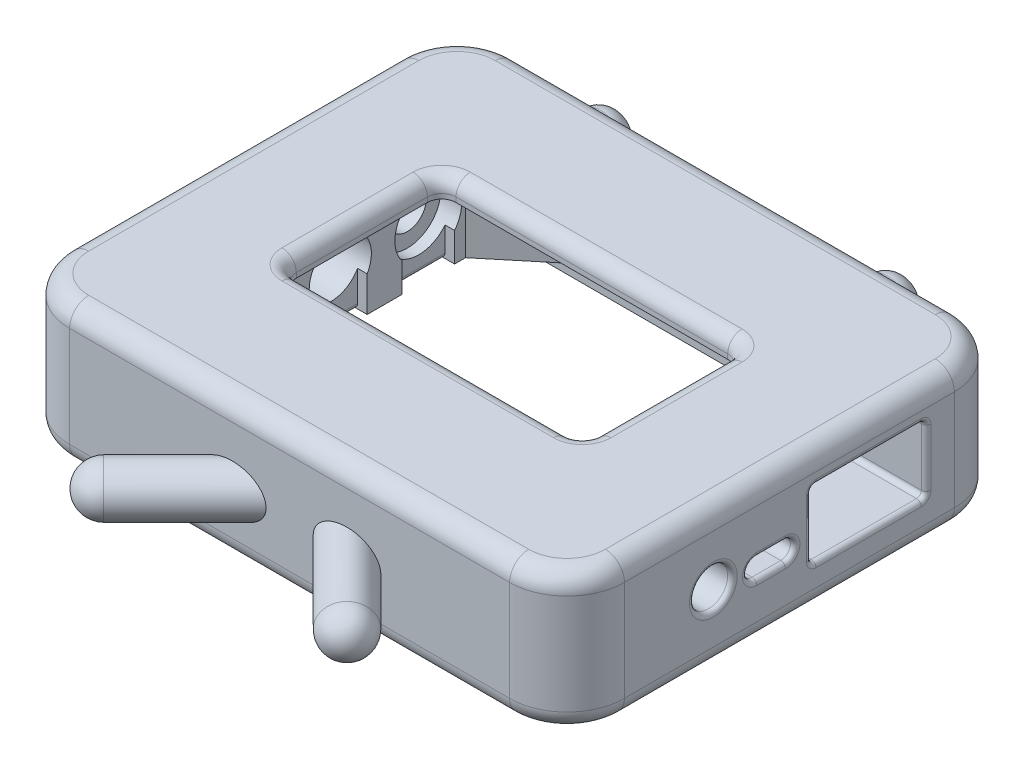
from build123d import *

# Parameters (mm, degrees)
SKETCH_1_W                  = 58
SKETCH_1_H                  = 46.5
SKETCH_1_W_2                = 38.4
SKETCH_1_H_2                = 37.4
EXTRUDE_1_DEPTH             = 12.5
SKETCH_2_W                  = 58
SKETCH_2_H                  = 46.5
SKETCH_2_W_2                = 31.4
SKETCH_2_H_2                = 16.7
EXTRUDE_2_DEPTH             = 2
FILLET_1_R                  = 6
EXTRUDE_3_DEPTH             = 12
EXTRUDE_3_DEPTH_BACK        = 3
SKETCH_8_R                  = 2.5
EXTRUDE_4_DEPTH             = 12
EXTRUDE_4_DEPTH_BACK        = 3
SKETCH_9_R                  = 2.5
FILLET_8_R                  = 2.5
FILLET_10_R                 = 2
FILLET_11_R                 = 1.5
FILLET_12_R                 = 2
SKETCH_12_W                 = 50
SKETCH_12_H                 = 37.4
CUT_EXTRUDE_1_DEPTH         = 2
FILLET_13_R                 = 5
EXTRUDE_5_DEPTH             = 10.5
CUT_EXTRUDE_3_REACH         = 70.032
SKETCH_16_R                 = 3.25
CUT_EXTRUDE_4_REACH         = 70.032
SKETCH_17_R                 = 2
CUT_EXTRUDE_5_REACH         = 70.032
SKETCH_18_R                 = 2
CUT_EXTRUDE_6_REACH         = 70.032
CUT_EXTRUDE_7_REACH         = 70.032
SKETCH_20_W                 = 12
SKETCH_20_H                 = 7
FILLET_14_R                 = 0.5
FILLET_15_R                 = 0.5
SKETCH_21_R                 = 3.5
CUT_EXTRUDE_8_DEPTH         = 2.2
CUT_EXTRUDE_START           = -2.2
SKETCH_22_R                 = 3.5
CUT_EXTRUDE_9_DEPTH         = 2.2
SKETCH_23_W                 = 5.5
SKETCH_23_H                 = 5.21
CUT_EXTRUDE_10_DEPTH        = 1
FILLET_16_R                 = 0.5
EXTRUDE_6_DEPTH             = 3
EXTRUDE_6_DIRECTION_2_REACH = 66.465
SKETCH_26_R                 = 1.05
CUT_EXTRUDE_11_DEPTH        = 8
FILLET_19_R                 = 0.5
FILLET_20_R                 = 2


with BuildPart() as part:
    # 草图1 → 凸台-拉伸1 (new body)
    with BuildSketch(Plane(origin=(0, 0, 0), x_dir=(1, 0, 0), z_dir=(0, 1, 0))):
        Rectangle(SKETCH_1_W, SKETCH_1_H)
        with Locations((0, 1.45)):
            Rectangle(SKETCH_1_W_2, SKETCH_1_H_2, mode=Mode.SUBTRACT)
    extrude(amount=EXTRUDE_1_DEPTH)

    # 草图2 → 凸台-拉伸2 (add)
    with BuildSketch(Plane(origin=(0, 12.5, 0), x_dir=(1, 0, 0), z_dir=(0, 1, 0))):
        Rectangle(SKETCH_2_W, SKETCH_2_H)
        Rectangle(SKETCH_2_W_2, SKETCH_2_H_2, mode=Mode.SUBTRACT)
    extrude(amount=EXTRUDE_2_DEPTH)

    # 圆角1
    fillet_1_edges = [part.edges().sort_by_distance(p)[0] for p in [
        (29, 7.25, 23.25),
        (-29, 7.25, 23.25),
        (-29, 7.25, -23.25),
        (29, 7.25, -23.25),
    ]]
    fillet(fillet_1_edges, radius=FILLET_1_R)

    # 草图8 → 凸台-拉伸3 (add, two sides: drawn at the far end of the back side and taken through both)
    with BuildSketch(Plane(origin=(-14.625, 0, 14.625), x_dir=(0, -1, 0), z_dir=(-0.7071067811865512, 0, 0.7071067811865438)).offset(-EXTRUDE_3_DEPTH_BACK)):
        with Locations(Location((-6.5, 12.197591975, 0), (0, 0, 90))):
            Circle(SKETCH_8_R)
    extrude(amount=EXTRUDE_3_DEPTH + EXTRUDE_3_DEPTH_BACK)

    # 草图9 → 凸台-拉伸4 (add, two sides: drawn at the far end of the back side and taken through both)
    with BuildSketch(Plane(origin=(14.625, 0, 14.625), x_dir=(0, -1, 0), z_dir=(0.7071067811865464, 0, 0.7071067811865488)).offset(-EXTRUDE_4_DEPTH_BACK)):
        with Locations(Location((-6.5, -12.197591975, 0), (0, 0, 90))):
            Circle(SKETCH_9_R)
    extrude(amount=EXTRUDE_4_DEPTH + EXTRUDE_4_DEPTH_BACK)

    # 圆角8
    fillet_8_edges = [part.edges().sort_by_distance(p)[0] for p in [
        (-16.253048327, 6.5, 29.967514421),
        (12.717514421, 6.5, 33.503048327),
    ]]
    fillet(fillet_8_edges, radius=FILLET_8_R)

    # 圆角10
    fillet_10_edges = [part.edges().sort_by_distance(p)[0] for p in [
        (0, 0, -23.25),
        (29, 0, 0),
        (0, 0, 23.25),
        (-29, 0, 0),
        (27.242640687, 0, 21.492640687),
        (-27.242640687, 0, 21.492640687),
        (-27.242640687, 0, -21.492640687),
        (27.242640687, 0, -21.492640687),
    ]]
    fillet(fillet_10_edges, radius=FILLET_10_R)

    # 圆角11
    fillet_11_edges = [part.edges().sort_by_distance(p)[0] for p in [
        (-15.7, 14.5, 0),
        (-15.7, 13.5, 8.35),
        (0, 14.5, 8.35),
        (15.7, 13.5, 8.35),
        (15.7, 14.5, 0),
        (15.7, 13.5, -8.35),
        (0, 14.5, -8.35),
        (-15.7, 13.5, -8.35),
    ]]
    fillet(fillet_11_edges, radius=FILLET_11_R)

    # 圆角12
    fillet_12_edges = [part.edges().sort_by_distance(p)[0] for p in [
        (0, 14.5, -23.25),
        (29, 14.5, 0),
        (-29, 14.5, 0),
        (0, 14.5, 23.25),
        (27.242640687, 14.5, 21.492640687),
        (-27.242640687, 14.5, 21.492640687),
        (-27.242640687, 14.5, -21.492640687),
        (27.242640687, 14.5, -21.492640687),
    ]]
    fillet(fillet_12_edges, radius=FILLET_12_R)

    # 草图12 → 切除-拉伸1 (cut)
    with BuildSketch(Plane.XZ):
        with Locations((0, -1.45)):
            Rectangle(SKETCH_12_W, SKETCH_12_H)
    extrude(amount=-CUT_EXTRUDE_1_DEPTH, mode=Mode.SUBTRACT)

    # 圆角13
    fillet_13_edges = [part.edges().sort_by_distance(p)[0] for p in [
        (25, 1, -20.15),
        (-25, 1, -20.15),
        (-25, 1, 17.25),
        (25, 1, 17.25),
    ]]
    fillet(fillet_13_edges, radius=FILLET_13_R)

    # 草图14 → 凸台-拉伸5 (add)
    with BuildSketch(Plane.XZ.offset(-12.5)):
        Polygon((-12.2, 17.25), (-19.2, 11.45), (-19.2, 17.25), align=None)
        Polygon((19.2, 17.25), (12.2, 17.25), (19.2, 11.45), align=None)
        Polygon((12.2, -20.15), (19.2, -14.35), (19.2, -20.15), align=None)
        Polygon((-19.2, -20.15), (-12.2, -20.15), (-19.2, -14.35), align=None)
    extrude(amount=EXTRUDE_5_DEPTH)

    # 草图16 → 切除-拉伸3 (cut, up to next)
    with BuildSketch(Plane.ZY.offset(29), mode=Mode.PRIVATE) as cut_extrude_3_sk1:
        with Locations((-1.25, 7.32)):
            Circle(SKETCH_16_R)
    cut_extrude_3_tool1 = extrude(cut_extrude_3_sk1.sketch, amount=-CUT_EXTRUDE_3_REACH, mode=Mode.PRIVATE) & part.part
    add(cut_extrude_3_tool1.solids().sort_by_distance((-29, 7.32, -1.25))[0], mode=Mode.SUBTRACT)

    # 草图17 → 切除-拉伸4 (cut, up to next)
    with BuildSketch(Plane.ZY.offset(29), mode=Mode.PRIVATE) as cut_extrude_4_sk1:
        with Locations((7.95, 7.21)):
            Circle(SKETCH_17_R)
    cut_extrude_4_tool1 = extrude(cut_extrude_4_sk1.sketch, amount=-CUT_EXTRUDE_4_REACH, mode=Mode.PRIVATE) & part.part
    # 草图17 → 切除-拉伸4 (cut, up to next)
    with BuildSketch(Plane.ZY.offset(29), mode=Mode.PRIVATE) as cut_extrude_4_sk2:
        with Locations((-10.45, 7.21)):
            Circle(SKETCH_17_R)
    cut_extrude_4_tool2 = extrude(cut_extrude_4_sk2.sketch, amount=-CUT_EXTRUDE_4_REACH, mode=Mode.PRIVATE) & part.part
    add(cut_extrude_4_tool1.solids().sort_by_distance((-29, 7.21, 7.95))[0], mode=Mode.SUBTRACT)
    add(cut_extrude_4_tool2.solids().sort_by_distance((-29, 7.21, -10.45))[0], mode=Mode.SUBTRACT)

    # 草图18 → 切除-拉伸5 (cut, up to next)
    with BuildSketch(Plane(origin=(29, 0, 0), x_dir=(0, 0, -1), z_dir=(1, 0, 0)), mode=Mode.PRIVATE) as cut_extrude_5_sk1:
        with Locations(Location((-7.95, 7.21, 0), (0, 0, 180))):
            Circle(SKETCH_18_R)
    cut_extrude_5_tool1 = extrude(cut_extrude_5_sk1.sketch, amount=-CUT_EXTRUDE_5_REACH, mode=Mode.PRIVATE) & part.part
    add(cut_extrude_5_tool1.solids().sort_by_distance((29, 7.21, 7.95))[0], mode=Mode.SUBTRACT)

    # 草图19 → 切除-拉伸6 (cut, up to next)
    with BuildSketch(Plane(origin=(29, 0, 0), x_dir=(0, 0, -1), z_dir=(1, 0, 0)), mode=Mode.PRIVATE) as cut_extrude_6_sk1:
        with BuildLine():
            Line((-3.4, 7.81), (-0.4, 7.81))
            ThreePointArc((-0.4, 7.81), (0.6, 6.81), (-0.4, 5.81))
            Line((-0.4, 5.81), (-3.4, 5.81))
            ThreePointArc((-3.4, 5.81), (-4.4, 6.81), (-3.4, 7.81))
        make_face()
    cut_extrude_6_tool1 = extrude(cut_extrude_6_sk1.sketch, amount=-CUT_EXTRUDE_6_REACH, mode=Mode.PRIVATE) & part.part
    add(cut_extrude_6_tool1.solids().sort_by_distance((29, 6.81, 1.9))[0], mode=Mode.SUBTRACT)

    # 草图20 → 切除-拉伸7 (cut, up to next)
    with BuildSketch(Plane(origin=(29, 0, 0), x_dir=(0, 0, -1), z_dir=(1, 0, 0)), mode=Mode.PRIVATE) as cut_extrude_7_sk1:
        with Locations((8.29, 7.82)):
            Rectangle(SKETCH_20_W, SKETCH_20_H)
    cut_extrude_7_tool1 = extrude(cut_extrude_7_sk1.sketch, amount=-CUT_EXTRUDE_7_REACH, mode=Mode.PRIVATE) & part.part
    add(cut_extrude_7_tool1.solids().sort_by_distance((29, 7.82, -8.29))[0], mode=Mode.SUBTRACT)

    # 圆角14
    fillet_14_edges = [part.edges().sort_by_distance(p)[0] for p in [
        (-29, 7.32, -4.5),
        (-29, 7.21, 5.95),
        (-29, 7.21, -12.45),
        (29, 7.21, 5.95),
        (29, 6.81, 4.4),
        (29, 5.81, 1.9),
        (29, 6.81, -0.6),
        (29, 7.81, 1.9),
        (24.1, 11.32, -14.29),
        (24.1, 4.32, -14.29),
        (24.1, 4.32, -2.29),
        (24.1, 11.32, -2.29),
    ]]
    fillet(fillet_14_edges, radius=FILLET_14_R)

    # 圆角15
    fillet_15_edges = [part.edges().sort_by_distance(p)[0] for p in [
        (29, 11.32, -8.29),
        (29, 7.82, -14.29),
        (29, 4.32, -8.29),
        (29, 7.82, -2.29),
        (29, 11.173553391, -14.143553391),
        (29, 4.466446609, -14.143553391),
        (29, 4.466446609, -2.436446609),
        (29, 11.173553391, -2.436446609),
    ]]
    fillet(fillet_15_edges, radius=FILLET_15_R)

    # 草图21 → 切除-拉伸8 (cut)
    with BuildSketch(Plane.ZY.offset(-19.2)):
        with Locations((7.95, 7.21)):
            Circle(SKETCH_21_R)
    extrude(amount=-CUT_EXTRUDE_8_DEPTH, mode=Mode.SUBTRACT)

    # 草图22 → 切除-拉伸9 (cut)
    with BuildSketch(Plane(origin=(-19.2, 0, 0), x_dir=(0, 0, -1), z_dir=(1, 0, 0)).offset(CUT_EXTRUDE_START)):
        with Locations(Location((-7.95, 7.21, 0), (0, 0, 180))):
            Circle(SKETCH_22_R)
        with Locations((10.45, 7.21)):
            Circle(SKETCH_22_R)
    extrude(amount=CUT_EXTRUDE_9_DEPTH, mode=Mode.SUBTRACT)

    # 草图23 → 切除-拉伸10 (cut)
    with BuildSketch(Plane(origin=(-19.2, 0, 0), x_dir=(0, 0, -1), z_dir=(1, 0, 0))):
        with Locations((-7.95, 4.605)):
            Rectangle(SKETCH_23_W, SKETCH_23_H)
        with Locations((1.30806142, 4.605)):
            Rectangle(SKETCH_23_W, SKETCH_23_H)
        with Locations((10.45, 4.605)):
            Rectangle(SKETCH_23_W, SKETCH_23_H)
    extrude(amount=-CUT_EXTRUDE_10_DEPTH, mode=Mode.SUBTRACT)

    # 圆角16
    fillet_16_edges = [part.edges().sort_by_distance(p)[0] for p in [
        (-20.2, 2, 7.95),
        (-20.2, 2, -1.30806142),
        (-20.2, 2, -10.45),
    ]]
    fillet(fillet_16_edges, radius=FILLET_16_R)

    # 草图24 → 凸台-拉伸6 (add)
    with BuildSketch(Plane(origin=(0, 0, -23.25), x_dir=(-1, 0, 0), z_dir=(0, 0, -1))):
        with BuildLine():
            Line((12.5, 10), (12.5, 0))
            Line((12.5, 0), (17.5, 0))
            Line((17.5, 0), (17.5, 10))
            ThreePointArc((17.5, 10), (15, 12.5), (12.5, 10))
        make_face()
        with BuildLine():
            Line((-17.5, 10), (-17.5, 0))
            Line((-17.5, 0), (-12.5, 0))
            Line((-12.5, 0), (-12.5, 10))
            ThreePointArc((-12.5, 10), (-15, 12.5), (-17.5, 10))
        make_face()
    extrude(amount=EXTRUDE_6_DEPTH)

    # 草图24 → 凸台-拉伸6 direction 2 (add, up to next)
    with BuildSketch(Plane(origin=(0, 0, -23.25), x_dir=(-1, 0, 0), z_dir=(0, 0, -1)), mode=Mode.PRIVATE) as extrude_6_direction_2_sk1:
        with BuildLine():
            Line((12.5, 10), (12.5, 0))
            Line((12.5, 0), (17.5, 0))
            Line((17.5, 0), (17.5, 10))
            ThreePointArc((17.5, 10), (15, 12.5), (12.5, 10))
        make_face()
    extrude_6_direction_2_tool1 = extrude(extrude_6_direction_2_sk1.sketch, amount=-EXTRUDE_6_DIRECTION_2_REACH, mode=Mode.PRIVATE) - part.part
    # 草图24 → 凸台-拉伸6 direction 2 (add, up to next)
    with BuildSketch(Plane(origin=(0, 0, -23.25), x_dir=(-1, 0, 0), z_dir=(0, 0, -1)), mode=Mode.PRIVATE) as extrude_6_direction_2_sk2:
        with BuildLine():
            Line((-17.5, 10), (-17.5, 0))
            Line((-17.5, 0), (-12.5, 0))
            Line((-12.5, 0), (-12.5, 10))
            ThreePointArc((-12.5, 10), (-15, 12.5), (-17.5, 10))
        make_face()
    extrude_6_direction_2_tool2 = extrude(extrude_6_direction_2_sk2.sketch, amount=-EXTRUDE_6_DIRECTION_2_REACH, mode=Mode.PRIVATE) - part.part
    add(extrude_6_direction_2_tool1.solids().sort_by_distance((-15, 5.99476, -23.25))[0])
    add(extrude_6_direction_2_tool2.solids().sort_by_distance((15, 5.99476, -23.25))[0])

    # 草图26 → 切除-拉伸11 (cut)
    with BuildSketch(Plane.XZ.offset(-2)):
        with Locations(Location((-20, 14.55, 0), (0, 0, 270))):
            Circle(SKETCH_26_R)
        with Locations(Location((20, 14.55, 0), (0, 0, 90))):
            Circle(SKETCH_26_R)
        with Locations(Location((20, -17.45, 0), (0, 0, 270))):
            Circle(SKETCH_26_R)
        with Locations(Location((-20, -17.45, 0), (0, 0, 90))):
            Circle(SKETCH_26_R)
    extrude(amount=-CUT_EXTRUDE_11_DEPTH, mode=Mode.SUBTRACT)

    # 圆角19
    fillet_19_edges = [part.edges().sort_by_distance(p)[0] for p in [
        (-20, 2, -18.5),
        (20, 2, -16.4),
        (20, 2, 13.5),
        (-20, 2, 15.6),
    ]]
    fillet(fillet_19_edges, radius=FILLET_19_R)

    # 圆角20
    fillet_20_edges = [part.edges().sort_by_distance(p)[0] for p in [
        (12.5, 5, -26.25),
        (15, 12.5, -26.25),
        (17.5, 5, -26.25),
        (15, 0, -26.25),
        (-17.5, 5, -26.25),
        (-12.5, 5, -26.25),
        (17.5, 0, -23.75),
        (12.5, 0, -23.75),
        (-17.5, 0, -23.75),
        (-12.5, 0, -23.75),
        (-15, 0, -26.25),
        (-15, 12.5, -26.25),
    ]]
    fillet(fillet_20_edges, radius=FILLET_20_R)


solid = part.part
